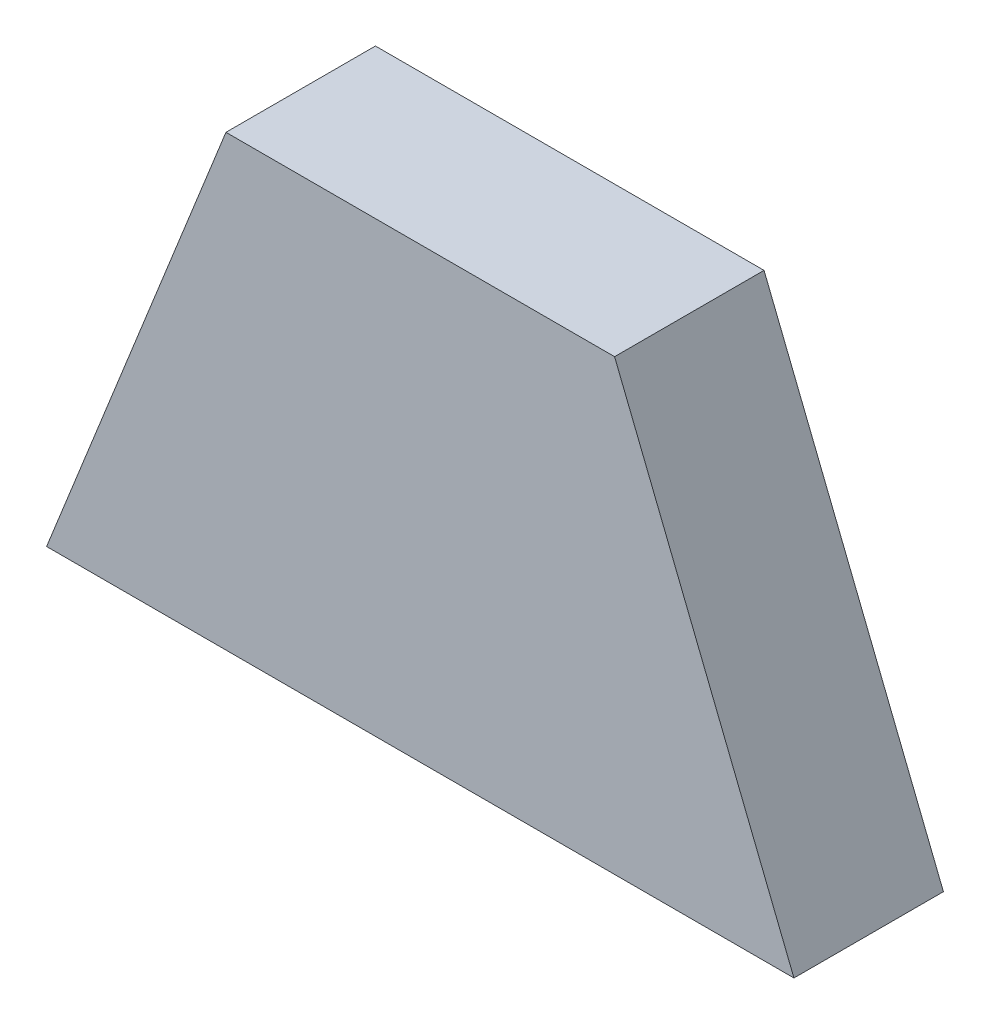
from build123d import *

# Parameters (mm, degrees)
EXTRUDE_1_DEPTH = 10


with BuildPart() as part:
    # 草圖1 → 填料-伸長1 (new body)
    with BuildSketch(Plane.XY):
        Polygon((0, 0), (50, 0), (38, 30), (12, 30), align=None)
    extrude(amount=-EXTRUDE_1_DEPTH)


solid = part.part
